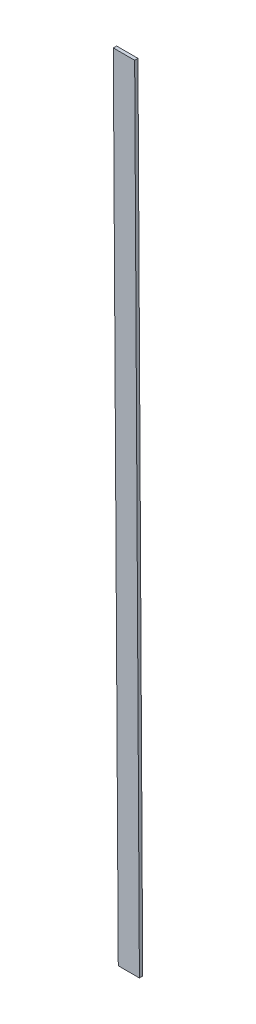
from build123d import *

# Parameters (mm, degrees)
BOSS_EXTRUDE1_DEPTH = 1.5875


with BuildPart() as part:
    # Sketch1 → Boss-Extrude1 (new body)
    with BuildSketch(Plane.XY):
        Polygon((50.189165418, -88.349549943), (60.349165418, -88.349549943), (58.070204318, 292.660937796), (47.798286328, 292.660937796), align=None)
    extrude(amount=BOSS_EXTRUDE1_DEPTH)


solid = part.part
